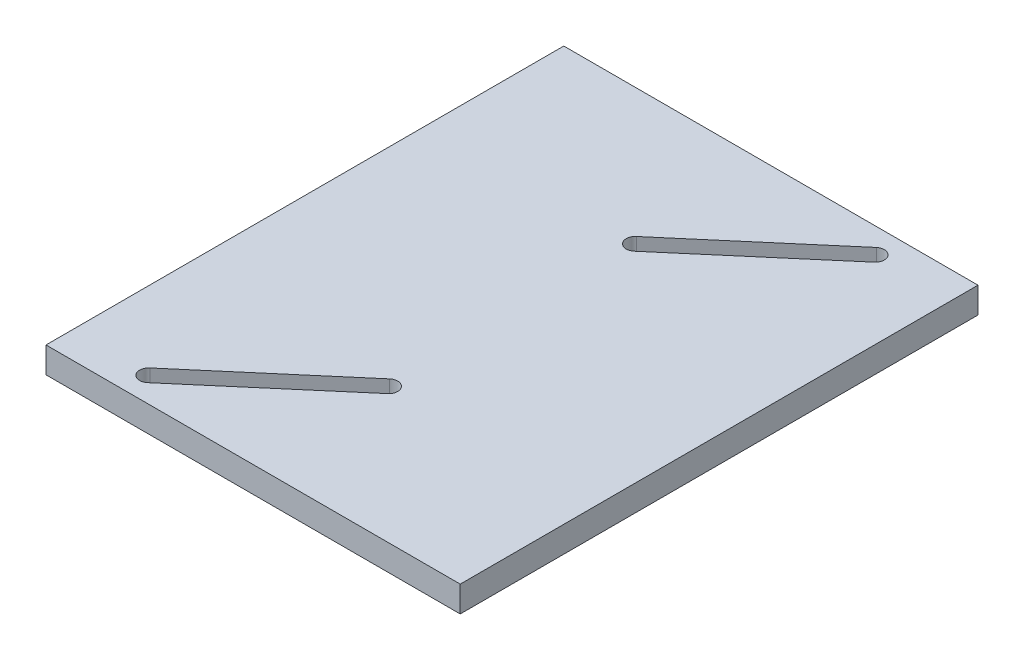
from build123d import *

# Parameters (mm, degrees)
SKETCH1_W           = 101.6
SKETCH1_H           = 127
BOSS_EXTRUDE1_DEPTH = 6.35
CUT_EXTRUDE1_DEPTH  = 82.567226875


with BuildPart() as part:
    # Sketch1 → Boss-Extrude1 (new body)
    with BuildSketch(Plane(origin=(0, 0, 0), x_dir=(1, 0, 0), z_dir=(0, 1, 0))):
        Rectangle(SKETCH1_W, SKETCH1_H)
    extrude(amount=BOSS_EXTRUDE1_DEPTH)

    # Sketch2 → Cut-Extrude1 (cut, through all)
    with BuildSketch(Plane(origin=(0, 6.35, 0), x_dir=(1, 0, 0), z_dir=(0, 1, 0))):
        with BuildLine():
            Line((-1.44277192, 31.939397026), (30.30722808, 59.036117026))
            ThreePointArc((30.30722808, 59.036117026), (33.440537026, 58.78835192), (33.19277192, 55.655042974))
            Line((33.19277192, 55.655042974), (1.44277192, 28.558322974))
            ThreePointArc((1.44277192, 28.558322974), (-1.690537026, 28.80608808), (-1.44277192, 31.939397026))
        make_face()
        with BuildLine():
            Line((1.44277192, -31.939397026), (-30.30722808, -59.036117026))
            ThreePointArc((-30.30722808, -59.036117026), (-33.440537026, -58.78835192), (-33.19277192, -55.655042974))
            Line((-33.19277192, -55.655042974), (-1.44277192, -28.558322974))
            ThreePointArc((-1.44277192, -28.558322974), (1.690537026, -28.80608808), (1.44277192, -31.939397026))
        make_face()
    extrude(amount=-CUT_EXTRUDE1_DEPTH, mode=Mode.SUBTRACT)


solid = part.part
